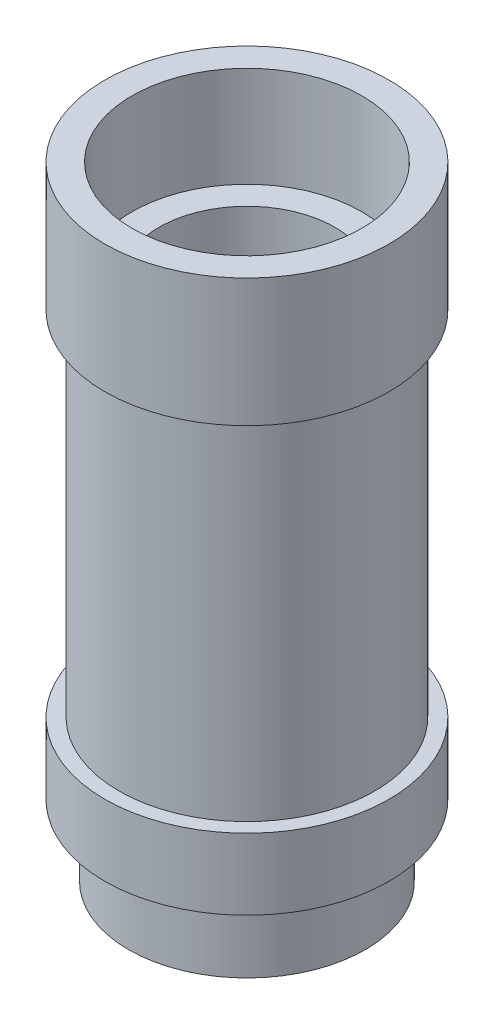
from build123d import *

# Parameters (mm, degrees)
SKETCH1_R           = 50
BOSS_EXTRUDE2_DEPTH = 30
SKETCH3_R           = 60
BOSS_EXTRUDE3_DEPTH = 30
SKETCH4_R           = 54
BOSS_EXTRUDE4_DEPTH = 149
SKETCH5_R           = 60
BOSS_EXTRUDE5_DEPTH = 54


with BuildPart() as part:
    # Sketch1 → Boss-Extrude2 (new body)
    with BuildSketch(Plane(origin=(0, 0, 0), x_dir=(1, 0, 0), z_dir=(0, 1, 0))):
        Circle(SKETCH1_R)
    extrude(amount=BOSS_EXTRUDE2_DEPTH)

    # Sketch3 → Boss-Extrude3 (add)
    with BuildSketch(Plane(origin=(0, 30, 0), x_dir=(1, 0, 0), z_dir=(0, 1, 0))):
        Circle(SKETCH3_R)
    extrude(amount=BOSS_EXTRUDE3_DEPTH)

    # Sketch4 → Boss-Extrude4 (add)
    with BuildSketch(Plane(origin=(0, 60, 0), x_dir=(1, 0, 0), z_dir=(0, 1, 0))):
        Circle(SKETCH4_R)
    extrude(amount=BOSS_EXTRUDE4_DEPTH)

    # Sketch5 → Boss-Extrude5 (add)
    with BuildSketch(Plane(origin=(0, 209, 0), x_dir=(1, 0, 0), z_dir=(0, 1, 0))):
        Circle(SKETCH5_R)
    extrude(amount=BOSS_EXTRUDE5_DEPTH)

    # Sketch7 → Cut-Revolve3 (revolve, cut)
    with BuildSketch(Plane.XY):
        Polygon((0, 273.958246316), (0, -7.633446841), (-30, -7.633446841), (-30, 37.558235381), (-48.50368091, 37.558235381), (-48.50368091, 51.558235381), (-37.146978401, 51.558235381), (-37.146978401, 220.582243692), (-48.50368091, 220.582243692), (-48.50368091, 273.958246316), align=None)
    revolve(axis=Axis((0, 273.958246316, 0), (0, -1, 0)), mode=Mode.SUBTRACT)


solid = part.part
